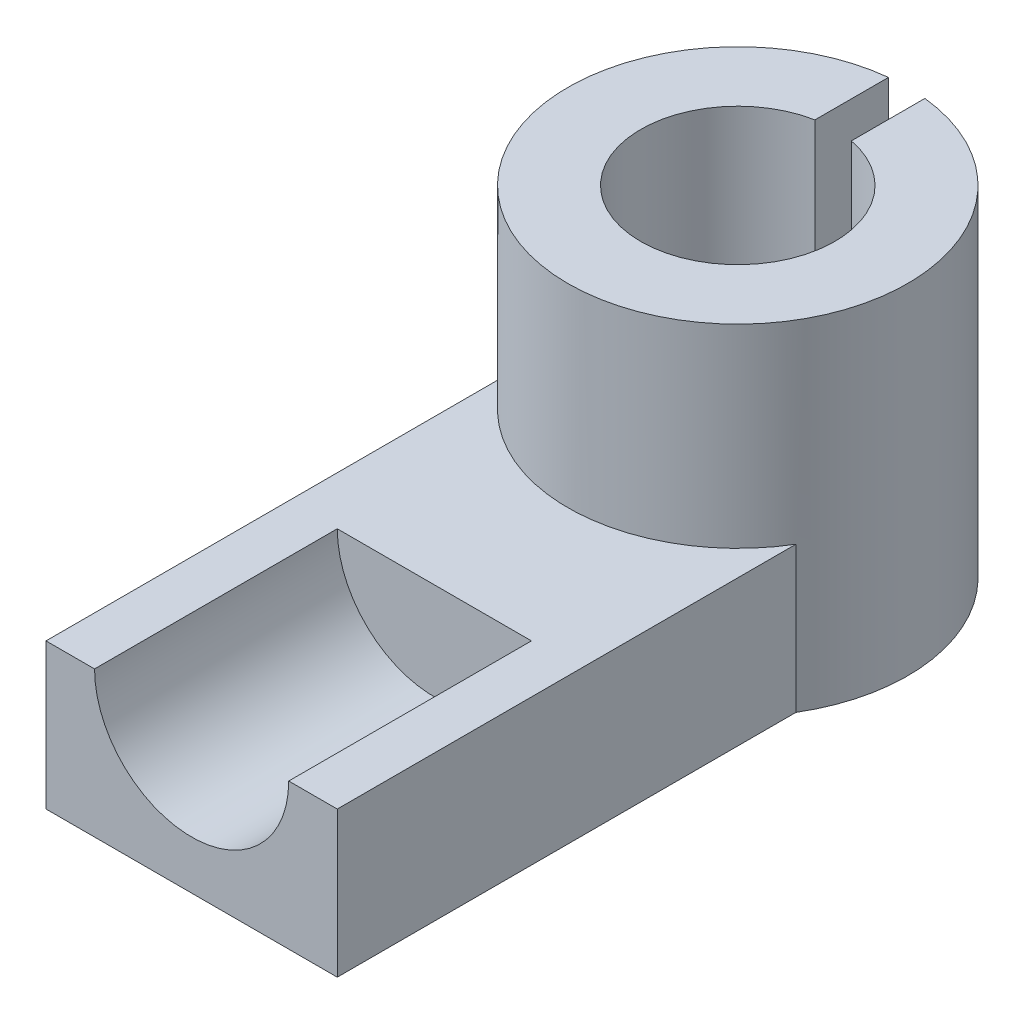
from build123d import *

# Parameters (mm, degrees)
SKETCH1_R           = 28
SKETCH1_R_2         = 16
BOSS_EXTRUDE1_DEPTH = 56
SKETCH2_W           = 6
SKETCH2_H           = 26.561532736
CUT_EXTRUDE1_DEPTH  = 69.585712798
BOSS_EXTRUDE2_DEPTH = 24
SKETCH4_R           = 16
CUT_EXTRUDE2_DEPTH  = 40


with BuildPart() as part:
    # Sketch1 → Boss-Extrude1 (new body)
    with BuildSketch(Plane(origin=(0, 0, 0), x_dir=(1, 0, 0), z_dir=(0, 1, 0))):
        with Locations(Location((0, 0, 0), (0, 0, 270))):
            Circle(SKETCH1_R)
        with Locations(Location((0, 0, 0), (0, 0, 270))):
            Circle(SKETCH1_R_2, mode=Mode.SUBTRACT)
    extrude(amount=BOSS_EXTRUDE1_DEPTH)

    # Sketch2 → Cut-Extrude1 (cut, through all)
    with BuildSketch(Plane(origin=(0, 56, 0), x_dir=(1, 0, 0), z_dir=(0, 1, 0))):
        with Locations((0, 16)):
            Rectangle(SKETCH2_W, SKETCH2_H)
    extrude(amount=-CUT_EXTRUDE1_DEPTH, mode=Mode.SUBTRACT)

    # Sketch3 → Boss-Extrude2 (add)
    with BuildSketch(Plane.XZ):
        with BuildLine():
            Line((-24, 90), (24, 90))
            Line((24, 90), (24, 14.422205102))
            ThreePointArc((24, 14.422205102), (0, 28), (-24, 14.422205102))
            Line((-24, 14.422205102), (-24, 90))
        make_face()
    extrude(amount=-BOSS_EXTRUDE2_DEPTH)

    # Sketch4 → Cut-Extrude2 (cut)
    with BuildSketch(Plane.XY.offset(90)):
        with Locations((0, 24)):
            Circle(SKETCH4_R)
    extrude(amount=-CUT_EXTRUDE2_DEPTH, mode=Mode.SUBTRACT)


solid = part.part
